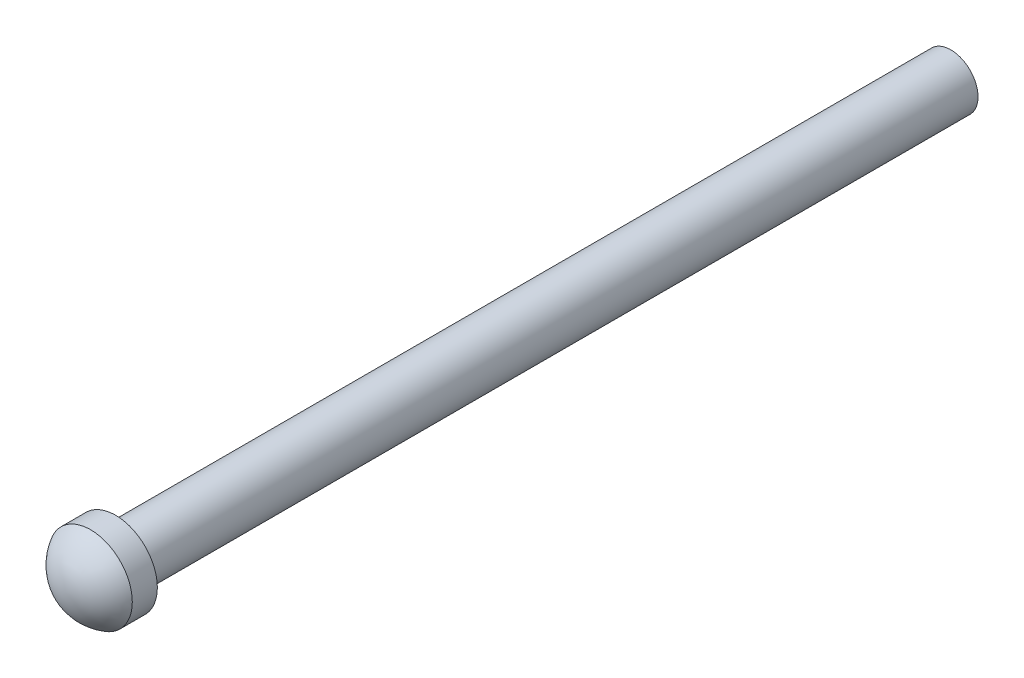
from build123d import *

# Parameters (mm, degrees)
SKETCH1_R           = 3.25
SKETCH3_R           = 5
BOSS_EXTRUDE1_DEPTH = 3
DOME1_FACE_RADIUS   = 5
DOME1_HEIGHT        = 3


with BuildPart() as part:
    # Sweep1: sweep along a path in Sketch2
    with BuildLine(Plane(origin=(0, 0, 0), x_dir=(0, 0, -1), z_dir=(1, 0, 0))) as sweep1_path:
        Line((0, 0), (100, 0))
    # Sketch1 → Sweep1 (sweep)
    with BuildSketch(Plane.XY):
        with Locations((5, 60)):
            Circle(SKETCH1_R)
    sweep(path=sweep1_path.line)

    # Sketch3 → Boss-Extrude1 (add)
    with BuildSketch(Plane.XY):
        with Locations((5, 60)):
            Circle(SKETCH3_R)
    extrude(amount=BOSS_EXTRUDE1_DEPTH)

    # Dome1: a dome of height H over a round flat face of radius A is a cap of a sphere of radius (A * A + H * H) / (2 * H)
    dome1_r = (DOME1_FACE_RADIUS * DOME1_FACE_RADIUS + DOME1_HEIGHT * DOME1_HEIGHT) / (2 * DOME1_HEIGHT)
    dome1_base = Plane((5, 60, 3), z_dir=(0, 0, 1))
    with Locations(dome1_base.offset(DOME1_HEIGHT - dome1_r)):
        dome1_ball = Sphere(dome1_r, mode=Mode.PRIVATE)
    add(split(dome1_ball, bisect_by=dome1_base, keep=Keep.TOP, mode=Mode.PRIVATE))


solid = part.part
